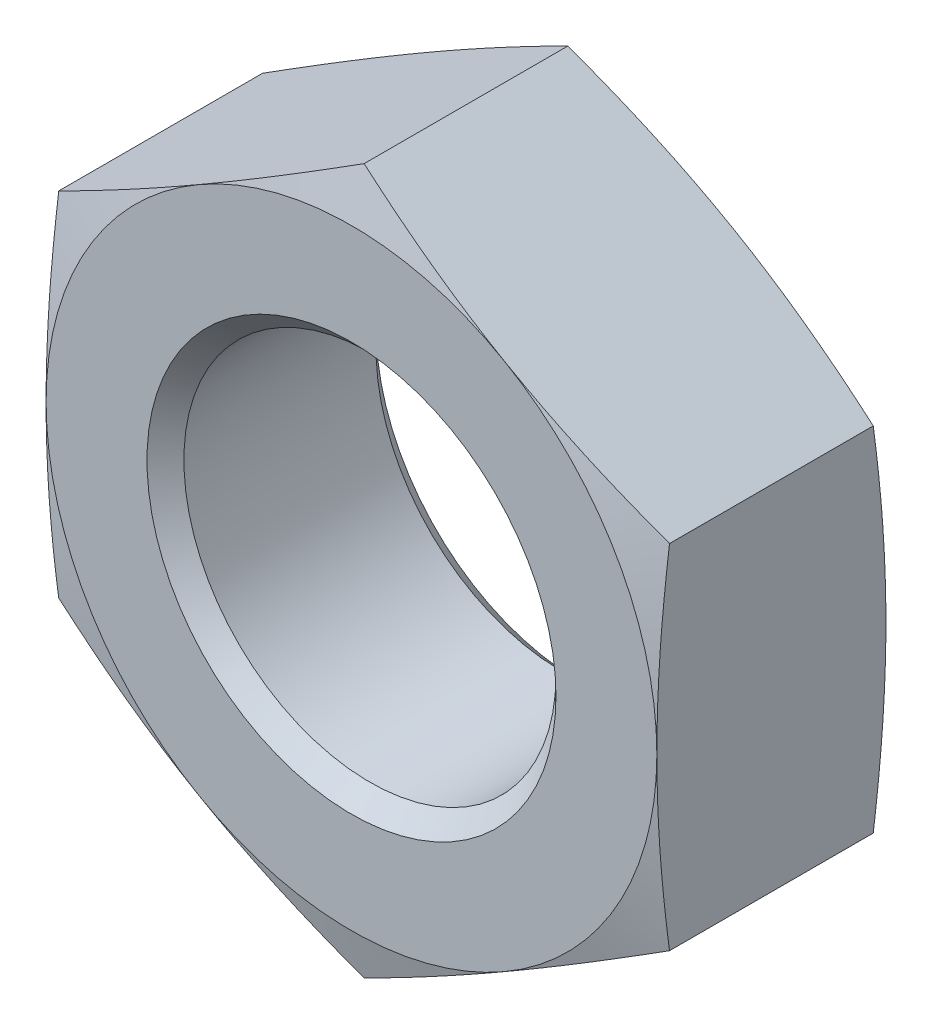
from build123d import *

# Parameters (mm, degrees)
SKETCH2_W          = 56.896
SKETCH2_H          = 56.896
CUT_EXTRUDE1_DEPTH = 10.668


with BuildPart() as part:
    # Sketch1 → Revolve1 (revolve)
    with BuildSketch(Plane(origin=(0, 0, 0), x_dir=(0, 0, -1), z_dir=(1, 0, 0)), mode=Mode.PRIVATE) as revolve1_sk:
        Polygon((0, 0), (0, 14.224), (0.762261863, 17.0688), (9.905738137, 17.0688), (10.668, 14.224), (10.668, 0), align=None)
    revolve(revolve1_sk.sketch.rotate(Axis((0, 0, -10.668), (0, 0, 1)), 270), axis=Axis((0, 0, -10.668), (0, 0, 1)))

    # Sketch2 → Cut-Extrude1 (cut)
    with BuildSketch(Plane.XY):
        Rectangle(SKETCH2_W, SKETCH2_H)
        Polygon((-14.224, 8.212230229), (-14.224, -8.212230229), (0, -16.424460458), (14.224, -8.212230229), (14.224, 8.212230229), (0, 16.424460458), align=None, mode=Mode.SUBTRACT)
    extrude(amount=-CUT_EXTRUDE1_DEPTH, mode=Mode.SUBTRACT)

    # Sketch3 → Cut-Revolve1 (revolve, cut)
    with BuildSketch(Plane(origin=(0, 0, 0), x_dir=(0, 0, -1), z_dir=(1, 0, 0)), mode=Mode.PRIVATE) as cut_revolve1_sk:
        Polygon((0, 0), (0, 9.525), (0.85979, 8.66521), (9.80821, 8.66521), (10.668, 9.525), (10.668, 0), align=None)
    revolve(cut_revolve1_sk.sketch.rotate(Axis((0, 0, -10.668), (0, 0, 1)), 270), axis=Axis((0, 0, -10.668), (0, 0, 1)), mode=Mode.SUBTRACT)


solid = part.part
